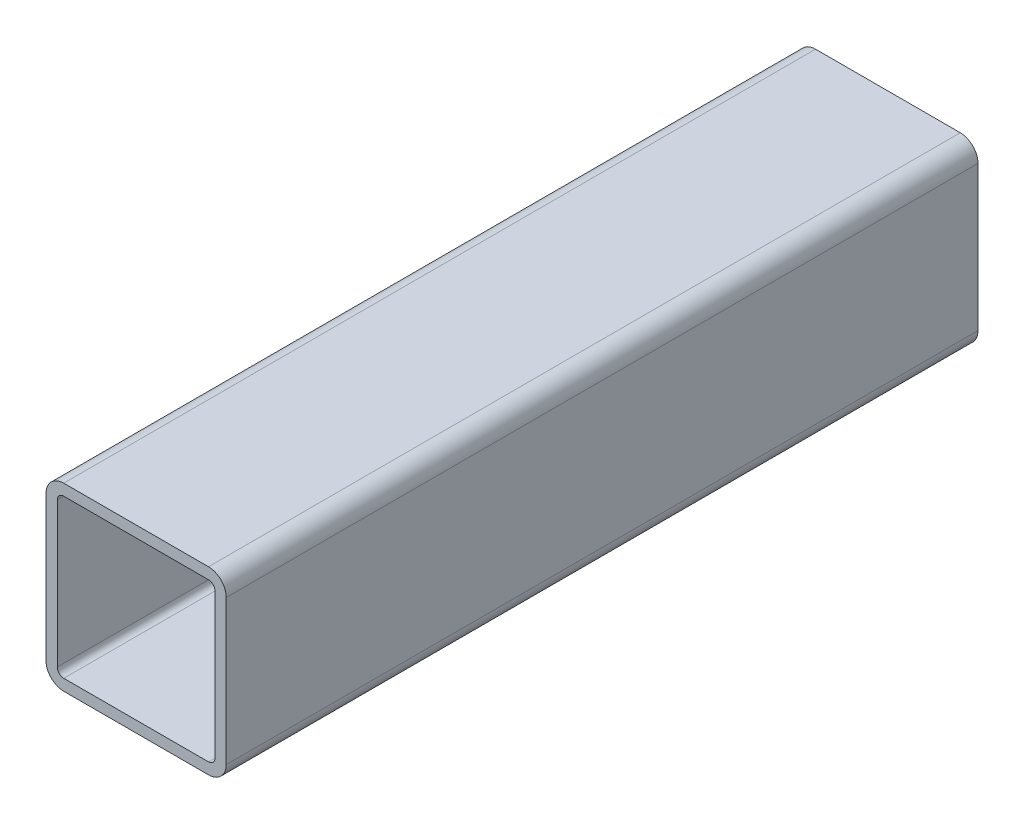
from build123d import *

# Parameters (mm, degrees)
BOSS_EXTRUDE1_DEPTH = 211.9


with BuildPart() as part:
    # Sketch1 → Boss-Extrude1 (new body)
    with BuildSketch(Plane.XY):
        with BuildLine():
            Line((-20.4, 25.4), (20.4, 25.4))
            ThreePointArc((20.4, 25.4), (23.935533906, 23.935533906), (25.4, 20.4))
            Line((25.4, 20.4), (25.4, -20.4))
            ThreePointArc((25.4, -20.4), (23.935533906, -23.935533906), (20.4, -25.4))
            Line((20.4, -25.4), (-20.4, -25.4))
            ThreePointArc((-20.4, -25.4), (-23.935533906, -23.935533906), (-25.4, -20.4))
            Line((-25.4, -20.4), (-25.4, 20.4))
            ThreePointArc((-25.4, 20.4), (-23.935533906, 23.935533906), (-20.4, 25.4))
        make_face()
        with BuildLine():
            Line((-22.225, 20.4), (-22.225, -20.4))
            ThreePointArc((-22.225, -20.4), (-21.690469876, -21.690469876), (-20.4, -22.225))
            Line((-20.4, -22.225), (20.4, -22.225))
            ThreePointArc((20.4, -22.225), (21.690469876, -21.690469876), (22.225, -20.4))
            Line((22.225, -20.4), (22.225, 20.4))
            ThreePointArc((22.225, 20.4), (21.690469876, 21.690469876), (20.4, 22.225))
            Line((20.4, 22.225), (-20.4, 22.225))
            ThreePointArc((-20.4, 22.225), (-21.690469876, 21.690469876), (-22.225, 20.4))
        make_face(mode=Mode.SUBTRACT)
    extrude(amount=BOSS_EXTRUDE1_DEPTH)


solid = part.part
